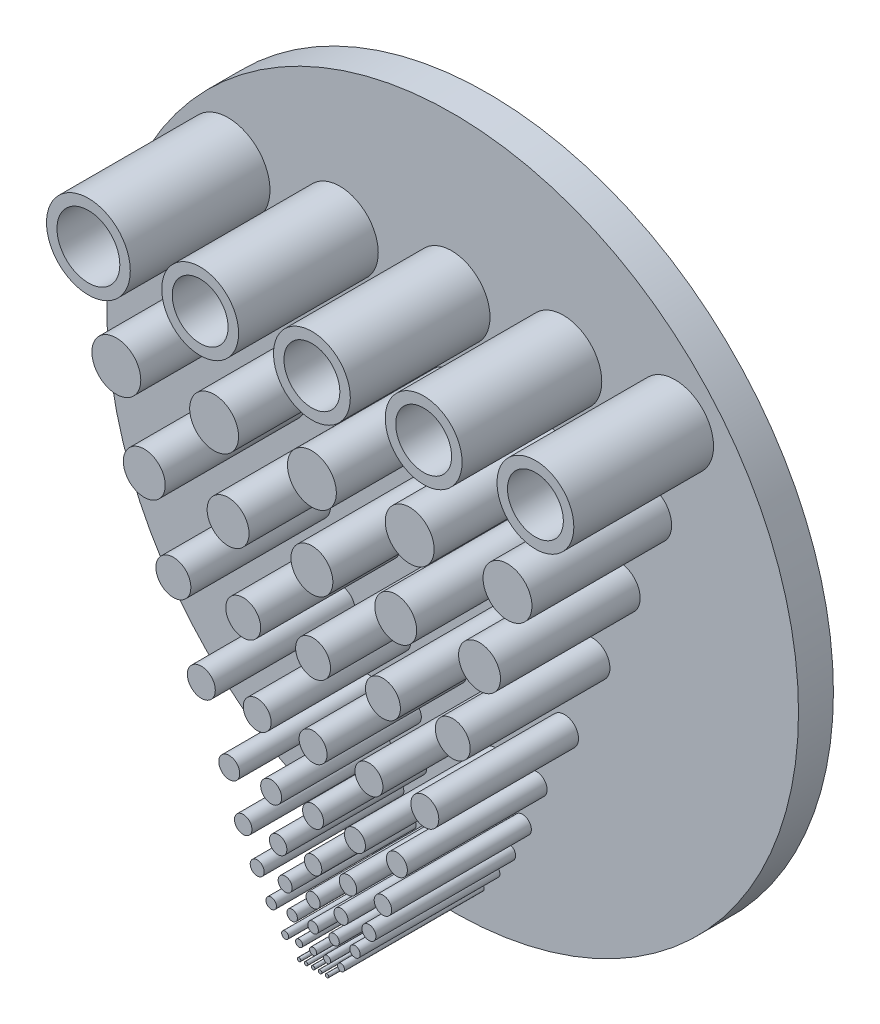
from build123d import *

# Parameters (mm, degrees)
SKETCH1_R              = 0.25
BOSS_EXTRUDE1_DEPTH    = 20
BOSS_EXTRUDE1_2_DEPTH  = 20
BOSS_EXTRUDE1_3_DEPTH  = 20
BOSS_EXTRUDE1_4_DEPTH  = 20
BOSS_EXTRUDE1_5_DEPTH  = 20
SKETCH1_R_2            = 0.5
BOSS_EXTRUDE1_6_DEPTH  = 20
BOSS_EXTRUDE1_7_DEPTH  = 20
BOSS_EXTRUDE1_8_DEPTH  = 20
BOSS_EXTRUDE1_9_DEPTH  = 20
BOSS_EXTRUDE1_10_DEPTH = 20
SKETCH1_R_3            = 1
BOSS_EXTRUDE1_11_DEPTH = 20
BOSS_EXTRUDE1_12_DEPTH = 20
BOSS_EXTRUDE1_13_DEPTH = 20
BOSS_EXTRUDE1_14_DEPTH = 20
BOSS_EXTRUDE1_15_DEPTH = 20
SKETCH1_R_4            = 1.5
BOSS_EXTRUDE1_16_DEPTH = 20
BOSS_EXTRUDE1_17_DEPTH = 20
BOSS_EXTRUDE1_18_DEPTH = 20
BOSS_EXTRUDE1_19_DEPTH = 20
BOSS_EXTRUDE1_20_DEPTH = 20
SKETCH1_R_5            = 2
BOSS_EXTRUDE1_21_DEPTH = 20
BOSS_EXTRUDE1_22_DEPTH = 20
BOSS_EXTRUDE1_23_DEPTH = 20
BOSS_EXTRUDE1_24_DEPTH = 20
BOSS_EXTRUDE1_25_DEPTH = 20
SKETCH1_R_6            = 2.5
BOSS_EXTRUDE1_26_DEPTH = 20
BOSS_EXTRUDE1_27_DEPTH = 20
BOSS_EXTRUDE1_28_DEPTH = 20
BOSS_EXTRUDE1_29_DEPTH = 20
BOSS_EXTRUDE1_30_DEPTH = 20
SKETCH1_R_7            = 3
BOSS_EXTRUDE1_31_DEPTH = 20
BOSS_EXTRUDE1_32_DEPTH = 20
BOSS_EXTRUDE1_33_DEPTH = 20
BOSS_EXTRUDE1_34_DEPTH = 20
BOSS_EXTRUDE1_35_DEPTH = 20
SKETCH1_R_8            = 3.5
BOSS_EXTRUDE1_36_DEPTH = 20
BOSS_EXTRUDE1_37_DEPTH = 20
BOSS_EXTRUDE1_38_DEPTH = 20
BOSS_EXTRUDE1_39_DEPTH = 20
BOSS_EXTRUDE1_40_DEPTH = 20
SKETCH1_R_9            = 4
BOSS_EXTRUDE1_41_DEPTH = 20
BOSS_EXTRUDE1_42_DEPTH = 20
BOSS_EXTRUDE1_43_DEPTH = 20
BOSS_EXTRUDE1_44_DEPTH = 20
BOSS_EXTRUDE1_45_DEPTH = 20
SKETCH1_R_10           = 1.25
BOSS_EXTRUDE1_46_DEPTH = 20
BOSS_EXTRUDE1_47_DEPTH = 20
BOSS_EXTRUDE1_48_DEPTH = 20
BOSS_EXTRUDE1_49_DEPTH = 20
BOSS_EXTRUDE1_50_DEPTH = 20
SKETCH1_R_11           = 0.75
BOSS_EXTRUDE1_51_DEPTH = 20
BOSS_EXTRUDE1_52_DEPTH = 20
BOSS_EXTRUDE1_53_DEPTH = 20
BOSS_EXTRUDE1_54_DEPTH = 20
BOSS_EXTRUDE1_55_DEPTH = 20
SKETCH4_R              = 49.5
BOSS_EXTRUDE2_DEPTH    = 5
BOSS_EXTRUDE3_START    = -20
SKETCH6_R              = 5.5
SKETCH6_R_2            = 4
SKETCH6_R_3            = 6
BOSS_EXTRUDE3_DEPTH    = 20
SKETCH7_R              = 4.5
SKETCH7_R_2            = 4
CUT_EXTRUDE1_DEPTH     = 20


with BuildPart() as part:
    # Sketch1 → Boss-Extrude1 (new body)
    with BuildSketch(Plane.XY):
        with Locations((0, -46.435439053)):
            Circle(SKETCH1_R)
    extrude(amount=BOSS_EXTRUDE1_DEPTH)



with BuildPart() as body_2:
    # Sketch1 → Boss-Extrude1 2 (new body)
    with BuildSketch(Plane.XY):
        with Locations((1, -46.435439053)):
            Circle(SKETCH1_R)
    extrude(amount=BOSS_EXTRUDE1_2_DEPTH)


with BuildPart() as body_3:
    # Sketch1 → Boss-Extrude1 3 (new body)
    with BuildSketch(Plane.XY):
        with Locations((2, -46.435439053)):
            Circle(SKETCH1_R)
    extrude(amount=BOSS_EXTRUDE1_3_DEPTH)


with BuildPart() as body_4:
    # Sketch1 → Boss-Extrude1 4 (new body)
    with BuildSketch(Plane.XY):
        with Locations((-1, -46.435439053)):
            Circle(SKETCH1_R)
    extrude(amount=BOSS_EXTRUDE1_4_DEPTH)


with BuildPart() as body_5:
    # Sketch1 → Boss-Extrude1 5 (new body)
    with BuildSketch(Plane.XY):
        with Locations((-2, -46.435439053)):
            Circle(SKETCH1_R)
    extrude(amount=BOSS_EXTRUDE1_5_DEPTH)


with BuildPart() as body_6:
    # Sketch1 → Boss-Extrude1 6 (new body)
    with BuildSketch(Plane.XY):
        with Locations((0, -44.400846234)):
            Circle(SKETCH1_R_2)
    extrude(amount=BOSS_EXTRUDE1_6_DEPTH)


with BuildPart() as body_7:
    # Sketch1 → Boss-Extrude1 7 (new body)
    with BuildSketch(Plane.XY):
        with Locations((2, -44.400846234)):
            Circle(SKETCH1_R_2)
    extrude(amount=BOSS_EXTRUDE1_7_DEPTH)


with BuildPart() as body_8:
    # Sketch1 → Boss-Extrude1 8 (new body)
    with BuildSketch(Plane.XY):
        with Locations((4, -44.400846234)):
            Circle(SKETCH1_R_2)
    extrude(amount=BOSS_EXTRUDE1_8_DEPTH)


with BuildPart() as body_9:
    # Sketch1 → Boss-Extrude1 9 (new body)
    with BuildSketch(Plane.XY):
        with Locations((-2, -44.400846234)):
            Circle(SKETCH1_R_2)
    extrude(amount=BOSS_EXTRUDE1_9_DEPTH)


with BuildPart() as body_10:
    # Sketch1 → Boss-Extrude1 10 (new body)
    with BuildSketch(Plane.XY):
        with Locations((-4, -44.400846234)):
            Circle(SKETCH1_R_2)
    extrude(amount=BOSS_EXTRUDE1_10_DEPTH)


with BuildPart() as body_11:
    # Sketch1 → Boss-Extrude1 11 (new body)
    with BuildSketch(Plane.XY):
        with Locations((0, -38.06669187)):
            Circle(SKETCH1_R_3)
    extrude(amount=BOSS_EXTRUDE1_11_DEPTH)


with BuildPart() as body_12:
    # Sketch1 → Boss-Extrude1 12 (new body)
    with BuildSketch(Plane.XY):
        with Locations((4, -38.06669187)):
            Circle(SKETCH1_R_3)
    extrude(amount=BOSS_EXTRUDE1_12_DEPTH)


with BuildPart() as body_13:
    # Sketch1 → Boss-Extrude1 13 (new body)
    with BuildSketch(Plane.XY):
        with Locations((8, -38.06669187)):
            Circle(SKETCH1_R_3)
    extrude(amount=BOSS_EXTRUDE1_13_DEPTH)


with BuildPart() as body_14:
    # Sketch1 → Boss-Extrude1 14 (new body)
    with BuildSketch(Plane.XY):
        with Locations((-4, -38.06669187)):
            Circle(SKETCH1_R_3)
    extrude(amount=BOSS_EXTRUDE1_14_DEPTH)


with BuildPart() as body_15:
    # Sketch1 → Boss-Extrude1 15 (new body)
    with BuildSketch(Plane.XY):
        with Locations((-8, -38.06669187)):
            Circle(SKETCH1_R_3)
    extrude(amount=BOSS_EXTRUDE1_15_DEPTH)


with BuildPart() as body_16:
    # Sketch1 → Boss-Extrude1 16 (new body)
    with BuildSketch(Plane.XY):
        with Locations((0, -27.622561985)):
            Circle(SKETCH1_R_4)
    extrude(amount=BOSS_EXTRUDE1_16_DEPTH)


with BuildPart() as body_17:
    # Sketch1 → Boss-Extrude1 17 (new body)
    with BuildSketch(Plane.XY):
        with Locations((6, -27.622561985)):
            Circle(SKETCH1_R_4)
    extrude(amount=BOSS_EXTRUDE1_17_DEPTH)


with BuildPart() as body_18:
    # Sketch1 → Boss-Extrude1 18 (new body)
    with BuildSketch(Plane.XY):
        with Locations((12, -27.622561985)):
            Circle(SKETCH1_R_4)
    extrude(amount=BOSS_EXTRUDE1_18_DEPTH)


with BuildPart() as body_19:
    # Sketch1 → Boss-Extrude1 19 (new body)
    with BuildSketch(Plane.XY):
        with Locations((-6, -27.622561985)):
            Circle(SKETCH1_R_4)
    extrude(amount=BOSS_EXTRUDE1_19_DEPTH)


with BuildPart() as body_20:
    # Sketch1 → Boss-Extrude1 20 (new body)
    with BuildSketch(Plane.XY):
        with Locations((-12, -27.622561985)):
            Circle(SKETCH1_R_4)
    extrude(amount=BOSS_EXTRUDE1_20_DEPTH)


with BuildPart() as body_21:
    # Sketch1 → Boss-Extrude1 21 (new body)
    with BuildSketch(Plane.XY):
        with Locations((0, -19.044753509)):
            Circle(SKETCH1_R_5)
    extrude(amount=BOSS_EXTRUDE1_21_DEPTH)


with BuildPart() as body_22:
    # Sketch1 → Boss-Extrude1 22 (new body)
    with BuildSketch(Plane.XY):
        with Locations((8, -19.044753509)):
            Circle(SKETCH1_R_5)
    extrude(amount=BOSS_EXTRUDE1_22_DEPTH)


with BuildPart() as body_23:
    # Sketch1 → Boss-Extrude1 23 (new body)
    with BuildSketch(Plane.XY):
        with Locations((16, -19.044753509)):
            Circle(SKETCH1_R_5)
    extrude(amount=BOSS_EXTRUDE1_23_DEPTH)


with BuildPart() as body_24:
    # Sketch1 → Boss-Extrude1 24 (new body)
    with BuildSketch(Plane.XY):
        with Locations((-8, -19.044753509)):
            Circle(SKETCH1_R_5)
    extrude(amount=BOSS_EXTRUDE1_24_DEPTH)


with BuildPart() as body_25:
    # Sketch1 → Boss-Extrude1 25 (new body)
    with BuildSketch(Plane.XY):
        with Locations((-16, -19.044753509)):
            Circle(SKETCH1_R_5)
    extrude(amount=BOSS_EXTRUDE1_25_DEPTH)


with BuildPart() as body_26:
    # Sketch1 → Boss-Extrude1 26 (new body)
    with BuildSketch(Plane.XY):
        with Locations((0, -8.042894353)):
            Circle(SKETCH1_R_6)
    extrude(amount=BOSS_EXTRUDE1_26_DEPTH)


with BuildPart() as body_27:
    # Sketch1 → Boss-Extrude1 27 (new body)
    with BuildSketch(Plane.XY):
        with Locations((10, -8.042894353)):
            Circle(SKETCH1_R_6)
    extrude(amount=BOSS_EXTRUDE1_27_DEPTH)


with BuildPart() as body_28:
    # Sketch1 → Boss-Extrude1 28 (new body)
    with BuildSketch(Plane.XY):
        with Locations((20, -8.042894353)):
            Circle(SKETCH1_R_6)
    extrude(amount=BOSS_EXTRUDE1_28_DEPTH)


with BuildPart() as body_29:
    # Sketch1 → Boss-Extrude1 29 (new body)
    with BuildSketch(Plane.XY):
        with Locations((-10, -8.042894353)):
            Circle(SKETCH1_R_6)
    extrude(amount=BOSS_EXTRUDE1_29_DEPTH)


with BuildPart() as body_30:
    # Sketch1 → Boss-Extrude1 30 (new body)
    with BuildSketch(Plane.XY):
        with Locations((-20, -8.042894353)):
            Circle(SKETCH1_R_6)
    extrude(amount=BOSS_EXTRUDE1_30_DEPTH)


with BuildPart() as body_31:
    # Sketch1 → Boss-Extrude1 31 (new body)
    with BuildSketch(Plane.XY):
        with Locations((-0.167579904, 2.789722097)):
            Circle(SKETCH1_R_7)
    extrude(amount=BOSS_EXTRUDE1_31_DEPTH)


with BuildPart() as body_32:
    # Sketch1 → Boss-Extrude1 32 (new body)
    with BuildSketch(Plane.XY):
        with Locations((11.832420096, 2.789722097)):
            Circle(SKETCH1_R_7)
    extrude(amount=BOSS_EXTRUDE1_32_DEPTH)


with BuildPart() as body_33:
    # Sketch1 → Boss-Extrude1 33 (new body)
    with BuildSketch(Plane.XY):
        with Locations((23.832420096, 2.789722097)):
            Circle(SKETCH1_R_7)
    extrude(amount=BOSS_EXTRUDE1_33_DEPTH)


with BuildPart() as body_34:
    # Sketch1 → Boss-Extrude1 34 (new body)
    with BuildSketch(Plane.XY):
        with Locations((-12.167579904, 2.789722097)):
            Circle(SKETCH1_R_7)
    extrude(amount=BOSS_EXTRUDE1_34_DEPTH)


with BuildPart() as body_35:
    # Sketch1 → Boss-Extrude1 35 (new body)
    with BuildSketch(Plane.XY):
        with Locations((-24.167579904, 2.789722097)):
            Circle(SKETCH1_R_7)
    extrude(amount=BOSS_EXTRUDE1_35_DEPTH)


with BuildPart() as body_36:
    # Sketch1 → Boss-Extrude1 36 (new body)
    with BuildSketch(Plane.XY):
        with Locations((-0.167579904, 14.071437835)):
            Circle(SKETCH1_R_8)
    extrude(amount=BOSS_EXTRUDE1_36_DEPTH)


with BuildPart() as body_37:
    # Sketch1 → Boss-Extrude1 37 (new body)
    with BuildSketch(Plane.XY):
        with Locations((13.832420096, 14.071437835)):
            Circle(SKETCH1_R_8)
    extrude(amount=BOSS_EXTRUDE1_37_DEPTH)


with BuildPart() as body_38:
    # Sketch1 → Boss-Extrude1 38 (new body)
    with BuildSketch(Plane.XY):
        with Locations((27.832420096, 14.071437835)):
            Circle(SKETCH1_R_8)
    extrude(amount=BOSS_EXTRUDE1_38_DEPTH)


with BuildPart() as body_39:
    # Sketch1 → Boss-Extrude1 39 (new body)
    with BuildSketch(Plane.XY):
        with Locations((-14.167579904, 14.071437835)):
            Circle(SKETCH1_R_8)
    extrude(amount=BOSS_EXTRUDE1_39_DEPTH)


with BuildPart() as body_40:
    # Sketch1 → Boss-Extrude1 40 (new body)
    with BuildSketch(Plane.XY):
        with Locations((-28.167579904, 14.071437835)):
            Circle(SKETCH1_R_8)
    extrude(amount=BOSS_EXTRUDE1_40_DEPTH)


with BuildPart() as body_41:
    # Sketch1 → Boss-Extrude1 41 (new body)
    with BuildSketch(Plane.XY):
        with Locations((-0.167579904, 26.876811398)):
            Circle(SKETCH1_R_9)
    extrude(amount=BOSS_EXTRUDE1_41_DEPTH)


with BuildPart() as body_42:
    # Sketch1 → Boss-Extrude1 42 (new body)
    with BuildSketch(Plane.XY):
        with Locations((15.832420096, 26.876811398)):
            Circle(SKETCH1_R_9)
    extrude(amount=BOSS_EXTRUDE1_42_DEPTH)


with BuildPart() as body_43:
    # Sketch1 → Boss-Extrude1 43 (new body)
    with BuildSketch(Plane.XY):
        with Locations((31.832420096, 26.876811398)):
            Circle(SKETCH1_R_9)
    extrude(amount=BOSS_EXTRUDE1_43_DEPTH)


with BuildPart() as body_44:
    # Sketch1 → Boss-Extrude1 44 (new body)
    with BuildSketch(Plane.XY):
        with Locations((-16.167579904, 26.876811398)):
            Circle(SKETCH1_R_9)
    extrude(amount=BOSS_EXTRUDE1_44_DEPTH)


with BuildPart() as body_45:
    # Sketch1 → Boss-Extrude1 45 (new body)
    with BuildSketch(Plane.XY):
        with Locations((-32.167579904, 26.876811398)):
            Circle(SKETCH1_R_9)
    extrude(amount=BOSS_EXTRUDE1_45_DEPTH)


with BuildPart() as body_46:
    # Sketch1 → Boss-Extrude1 46 (new body)
    with BuildSketch(Plane.XY):
        with Locations((0, -33.679004074)):
            Circle(SKETCH1_R_10)
    extrude(amount=BOSS_EXTRUDE1_46_DEPTH)


with BuildPart() as body_47:
    # Sketch1 → Boss-Extrude1 47 (new body)
    with BuildSketch(Plane.XY):
        with Locations((5, -33.679004074)):
            Circle(SKETCH1_R_10)
    extrude(amount=BOSS_EXTRUDE1_47_DEPTH)


with BuildPart() as body_48:
    # Sketch1 → Boss-Extrude1 48 (new body)
    with BuildSketch(Plane.XY):
        with Locations((10, -33.679004074)):
            Circle(SKETCH1_R_10)
    extrude(amount=BOSS_EXTRUDE1_48_DEPTH)


with BuildPart() as body_49:
    # Sketch1 → Boss-Extrude1 49 (new body)
    with BuildSketch(Plane.XY):
        with Locations((-5, -33.679004074)):
            Circle(SKETCH1_R_10)
    extrude(amount=BOSS_EXTRUDE1_49_DEPTH)


with BuildPart() as body_50:
    # Sketch1 → Boss-Extrude1 50 (new body)
    with BuildSketch(Plane.XY):
        with Locations((-10, -33.679004074)):
            Circle(SKETCH1_R_10)
    extrude(amount=BOSS_EXTRUDE1_50_DEPTH)


with BuildPart() as body_51:
    # Sketch1 → Boss-Extrude1 51 (new body)
    with BuildSketch(Plane.XY):
        with Locations((0, -41.43926503)):
            Circle(SKETCH1_R_11)
    extrude(amount=BOSS_EXTRUDE1_51_DEPTH)


with BuildPart() as body_52:
    # Sketch1 → Boss-Extrude1 52 (new body)
    with BuildSketch(Plane.XY):
        with Locations((-3, -41.43926503)):
            Circle(SKETCH1_R_11)
    extrude(amount=BOSS_EXTRUDE1_52_DEPTH)


with BuildPart() as body_53:
    # Sketch1 → Boss-Extrude1 53 (new body)
    with BuildSketch(Plane.XY):
        with Locations((-6, -41.43926503)):
            Circle(SKETCH1_R_11)
    extrude(amount=BOSS_EXTRUDE1_53_DEPTH)


with BuildPart() as body_54:
    # Sketch1 → Boss-Extrude1 54 (new body)
    with BuildSketch(Plane.XY):
        with Locations((3, -41.43926503)):
            Circle(SKETCH1_R_11)
    extrude(amount=BOSS_EXTRUDE1_54_DEPTH)


with BuildPart() as body_55:
    # Sketch1 → Boss-Extrude1 55 (new body)
    with BuildSketch(Plane.XY):
        with Locations((6, -41.43926503)):
            Circle(SKETCH1_R_11)
    extrude(amount=BOSS_EXTRUDE1_55_DEPTH)


with BuildPart() as part_1:
    add(part.part)

    add(body_2.part)  # Boss-Extrude2 merges body 2

    add(body_3.part)  # Boss-Extrude2 merges body 3

    add(body_4.part)  # Boss-Extrude2 merges body 4

    add(body_5.part)  # Boss-Extrude2 merges body 5

    add(body_6.part)  # Boss-Extrude2 merges body 6

    add(body_7.part)  # Boss-Extrude2 merges body 7

    add(body_8.part)  # Boss-Extrude2 merges body 8

    add(body_9.part)  # Boss-Extrude2 merges body 9

    add(body_10.part)  # Boss-Extrude2 merges body 10

    add(body_11.part)  # Boss-Extrude2 merges body 11

    add(body_12.part)  # Boss-Extrude2 merges body 12

    add(body_13.part)  # Boss-Extrude2 merges body 13

    add(body_14.part)  # Boss-Extrude2 merges body 14

    add(body_15.part)  # Boss-Extrude2 merges body 15

    add(body_16.part)  # Boss-Extrude2 merges body 16

    add(body_17.part)  # Boss-Extrude2 merges body 17

    add(body_18.part)  # Boss-Extrude2 merges body 18

    add(body_19.part)  # Boss-Extrude2 merges body 19

    add(body_20.part)  # Boss-Extrude2 merges body 20

    add(body_21.part)  # Boss-Extrude2 merges body 21

    add(body_22.part)  # Boss-Extrude2 merges body 22

    add(body_23.part)  # Boss-Extrude2 merges body 23

    add(body_24.part)  # Boss-Extrude2 merges body 24

    add(body_25.part)  # Boss-Extrude2 merges body 25

    add(body_26.part)  # Boss-Extrude2 merges body 26

    add(body_27.part)  # Boss-Extrude2 merges body 27

    add(body_28.part)  # Boss-Extrude2 merges body 28

    add(body_29.part)  # Boss-Extrude2 merges body 29

    add(body_30.part)  # Boss-Extrude2 merges body 30

    add(body_31.part)  # Boss-Extrude2 merges body 31

    add(body_32.part)  # Boss-Extrude2 merges body 32

    add(body_33.part)  # Boss-Extrude2 merges body 33

    add(body_34.part)  # Boss-Extrude2 merges body 34

    add(body_35.part)  # Boss-Extrude2 merges body 35

    add(body_36.part)  # Boss-Extrude2 merges body 36

    add(body_37.part)  # Boss-Extrude2 merges body 37

    add(body_38.part)  # Boss-Extrude2 merges body 38

    add(body_39.part)  # Boss-Extrude2 merges body 39

    add(body_40.part)  # Boss-Extrude2 merges body 40

    add(body_41.part)  # Boss-Extrude2 merges body 41

    add(body_42.part)  # Boss-Extrude2 merges body 42

    add(body_43.part)  # Boss-Extrude2 merges body 43

    add(body_44.part)  # Boss-Extrude2 merges body 44

    add(body_45.part)  # Boss-Extrude2 merges body 45

    add(body_46.part)  # Boss-Extrude2 merges body 46

    add(body_47.part)  # Boss-Extrude2 merges body 47

    add(body_48.part)  # Boss-Extrude2 merges body 48

    add(body_49.part)  # Boss-Extrude2 merges body 49

    add(body_50.part)  # Boss-Extrude2 merges body 50

    add(body_51.part)  # Boss-Extrude2 merges body 51

    add(body_52.part)  # Boss-Extrude2 merges body 52

    add(body_53.part)  # Boss-Extrude2 merges body 53

    add(body_54.part)  # Boss-Extrude2 merges body 54

    add(body_55.part)  # Boss-Extrude2 merges body 55
    # Sketch4 → Boss-Extrude2 (add)
    with BuildSketch(Plane.XY):
        Circle(SKETCH4_R)
    extrude(amount=-BOSS_EXTRUDE2_DEPTH)

    # Sketch6 → Boss-Extrude3 (add)
    # profile 1 of 5: a face of its own
    with BuildSketch(Plane.XY.offset(20).offset(BOSS_EXTRUDE3_START)):
        with Locations((-16.167579904, 26.876811398)):
            Circle(SKETCH6_R)
        with Locations((-16.167579904, 26.876811398)):
            Circle(SKETCH6_R_2, mode=Mode.SUBTRACT)
    # profile 2 of 5: a face of its own
    with BuildSketch(Plane.XY.offset(20).offset(BOSS_EXTRUDE3_START)):
        with Locations((-0.167579904, 26.876811398)):
            Circle(SKETCH6_R)
        with Locations((-0.167579904, 26.876811398)):
            Circle(SKETCH6_R_2, mode=Mode.SUBTRACT)
    # profile 3 of 5: a face of its own
    with BuildSketch(Plane.XY.offset(20).offset(BOSS_EXTRUDE3_START)):
        with Locations((15.832420096, 26.876811398)):
            Circle(SKETCH6_R)
        with Locations((15.832420096, 26.876811398)):
            Circle(SKETCH6_R_2, mode=Mode.SUBTRACT)
    # profile 4 of 5: a face of its own
    with BuildSketch(Plane.XY.offset(20).offset(BOSS_EXTRUDE3_START)):
        with Locations((31.832420096, 26.876811398)):
            Circle(SKETCH6_R)
        with Locations((31.832420096, 26.876811398)):
            Circle(SKETCH6_R_2, mode=Mode.SUBTRACT)
    # profile 5 of 5: a face of its own
    with BuildSketch(Plane.XY.offset(20).offset(BOSS_EXTRUDE3_START)):
        with Locations((-32.167579904, 26.876811398)):
            Circle(SKETCH6_R_3)
        with Locations((-32.167579904, 26.876811398)):
            Circle(SKETCH6_R_2, mode=Mode.SUBTRACT)
    extrude(amount=BOSS_EXTRUDE3_DEPTH)

    # Sketch7 → Cut-Extrude1 (cut)
    with BuildSketch(Plane.XY.offset(20)):
        with Locations((-32.167579904, 26.876811398)):
            Circle(SKETCH7_R)
        with Locations((-16.167579904, 26.876811398)):
            Circle(SKETCH7_R_2)
        with Locations((-0.167579904, 26.876811398)):
            Circle(SKETCH7_R_2)
        with Locations((15.832420096, 26.876811398)):
            Circle(SKETCH7_R_2)
        with Locations((31.832420096, 26.876811398)):
            Circle(SKETCH7_R_2)
    extrude(amount=-CUT_EXTRUDE1_DEPTH, mode=Mode.SUBTRACT)


solid = part_1.part
